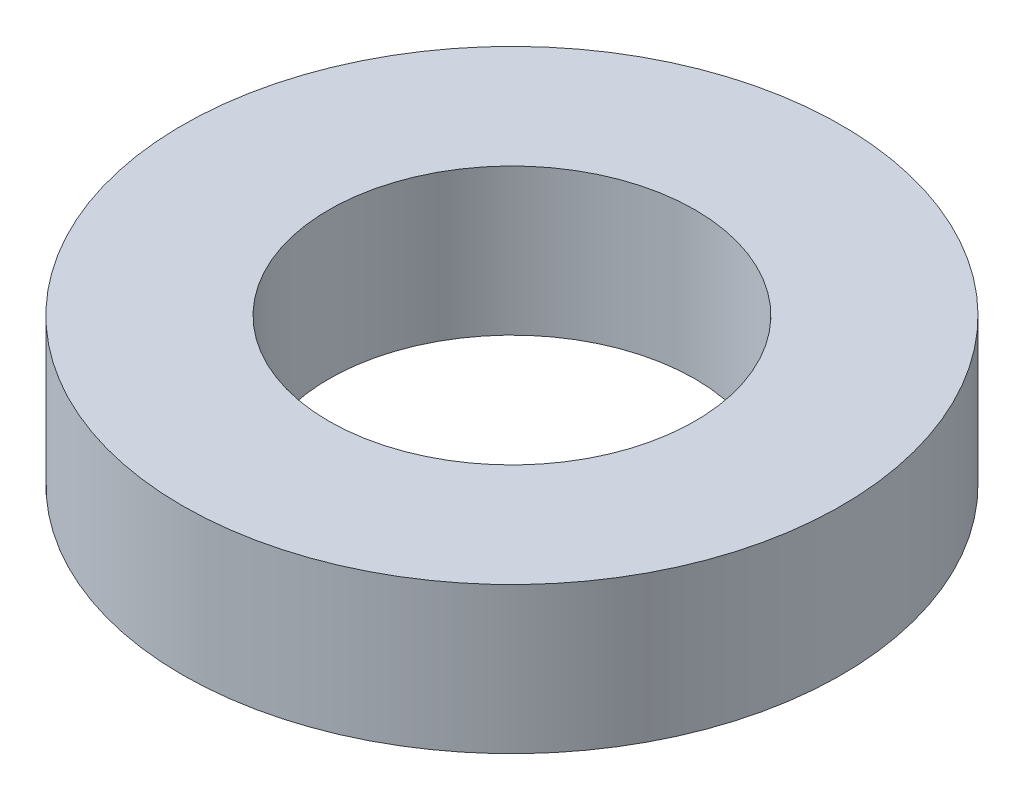
from build123d import *

# Parameters (mm, degrees)
SKETCH1_R           = 2.7
SKETCH1_R_2         = 1.5
BOSS_EXTRUDE1_DEPTH = 1.2


with BuildPart() as part:
    # Sketch1 → Boss-Extrude1 (new body)
    with BuildSketch(Plane(origin=(0, 0, 0), x_dir=(1, 0, 0), z_dir=(0, 1, 0))):
        with Locations(Location((0, 0, 0), (0, 0, 270))):
            Circle(SKETCH1_R)
        with Locations(Location((0, 0, 0), (0, 0, 270))):
            Circle(SKETCH1_R_2, mode=Mode.SUBTRACT)
    extrude(amount=BOSS_EXTRUDE1_DEPTH)


solid = part.part
